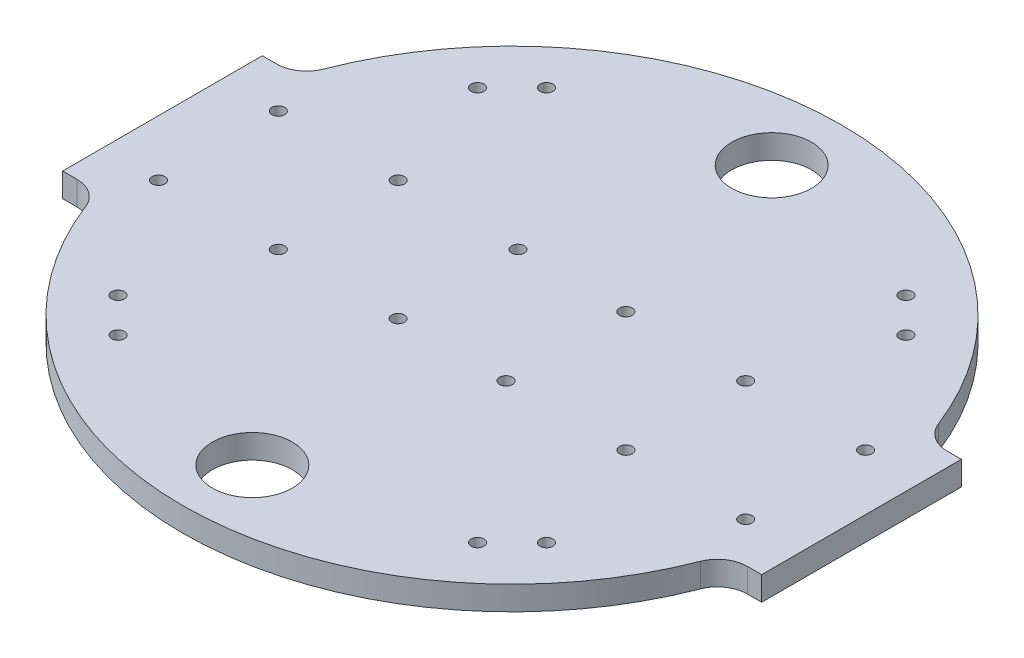
from build123d import *

# Parameters (mm, degrees)
ESQUISSE1_R        = 1.6
ESQUISSE1_R_2      = 10
BOSS_EXTRU_1_DEPTH = 6
CONG_1_R           = 7.5


with BuildPart() as part:
    # Esquisse1 → Boss.-Extru.1 (new body)
    with BuildSketch(Plane(origin=(0, 0, 0), x_dir=(1, 0, 0), z_dir=(0, 1, 0))):
        with BuildLine():
            Line((-87.5, 25), (-78.620925968, 25))
            ThreePointArc((-78.620925968, 25), (0, 82.5), (78.620925968, 25))
            Line((78.620925968, 25), (87.5, 25))
            Line((87.5, 25), (87.5, -25))
            Line((87.5, -25), (78.620925968, -25))
            ThreePointArc((78.620925968, -25), (0, -82.5), (-78.620925968, -25))
            Line((-78.620925968, -25), (-87.5, -25))
            Line((-87.5, -25), (-87.5, 25))
        make_face()
        with Locations(Location((-53.623111018, 44.995132678, 0), (0, 0, 270))):
            Circle(ESQUISSE1_R, mode=Mode.SUBTRACT)
        with Locations(Location((-44.995132678, 53.623111018, 0), (0, 0, 270))):
            Circle(ESQUISSE1_R, mode=Mode.SUBTRACT)
        with Locations(Location((53.623111018, 44.995132678, 0), (0, 0, 270))):
            Circle(ESQUISSE1_R, mode=Mode.SUBTRACT)
        with Locations(Location((44.995132678, 53.623111018, 0), (0, 0, 270))):
            Circle(ESQUISSE1_R, mode=Mode.SUBTRACT)
        with Locations(Location((44.995132678, -53.623111018, 0), (0, 0, 270))):
            Circle(ESQUISSE1_R, mode=Mode.SUBTRACT)
        with Locations(Location((53.623111018, -44.995132678, 0), (0, 0, 270))):
            Circle(ESQUISSE1_R, mode=Mode.SUBTRACT)
        with Locations(Location((-53.623111018, -44.995132678, 0), (0, 0, 270))):
            Circle(ESQUISSE1_R, mode=Mode.SUBTRACT)
        with Locations(Location((-44.995132678, -53.623111018, 0), (0, 0, 270))):
            Circle(ESQUISSE1_R, mode=Mode.SUBTRACT)
        with Locations(Location((0, 65, 0), (0, 0, 270))):
            Circle(ESQUISSE1_R_2, mode=Mode.SUBTRACT)
        with Locations(Location((0, -65, 0), (0, 0, 90))):
            Circle(ESQUISSE1_R_2, mode=Mode.SUBTRACT)
        with Locations(Location((-73.5, 15, 0), (0, 0, 270))):
            Circle(ESQUISSE1_R, mode=Mode.SUBTRACT)
        with Locations(Location((-73.5, -15, 0), (0, 0, 90))):
            Circle(ESQUISSE1_R, mode=Mode.SUBTRACT)
        with Locations(Location((-43.5, 15, 0), (0, 0, 270))):
            Circle(ESQUISSE1_R, mode=Mode.SUBTRACT)
        with Locations(Location((-43.5, -15, 0), (0, 0, 90))):
            Circle(ESQUISSE1_R, mode=Mode.SUBTRACT)
        with Locations(Location((-13.5, 15, 0), (0, 0, 270))):
            Circle(ESQUISSE1_R, mode=Mode.SUBTRACT)
        with Locations(Location((-13.5, -15, 0), (0, 0, 90))):
            Circle(ESQUISSE1_R, mode=Mode.SUBTRACT)
        with Locations(Location((13.5, -15, 0), (0, 0, 270))):
            Circle(ESQUISSE1_R, mode=Mode.SUBTRACT)
        with Locations(Location((13.5, 15, 0), (0, 0, 90))):
            Circle(ESQUISSE1_R, mode=Mode.SUBTRACT)
        with Locations(Location((43.5, 15, 0), (0, 0, 90))):
            Circle(ESQUISSE1_R, mode=Mode.SUBTRACT)
        with Locations(Location((43.5, -15, 0), (0, 0, 270))):
            Circle(ESQUISSE1_R, mode=Mode.SUBTRACT)
        with Locations(Location((73.5, -15, 0), (0, 0, 270))):
            Circle(ESQUISSE1_R, mode=Mode.SUBTRACT)
        with Locations(Location((73.5, 15, 0), (0, 0, 90))):
            Circle(ESQUISSE1_R, mode=Mode.SUBTRACT)
    extrude(amount=BOSS_EXTRU_1_DEPTH)

    # Congé1
    cong_1_edges = [part.edges().sort_by_distance(p)[0] for p in [
        (-78.620925968, 3, -25),
        (78.620925968, 3, -25),
        (78.620925968, 3, 25),
        (-78.620925968, 3, 25),
    ]]
    fillet(cong_1_edges, radius=CONG_1_R)


solid = part.part
